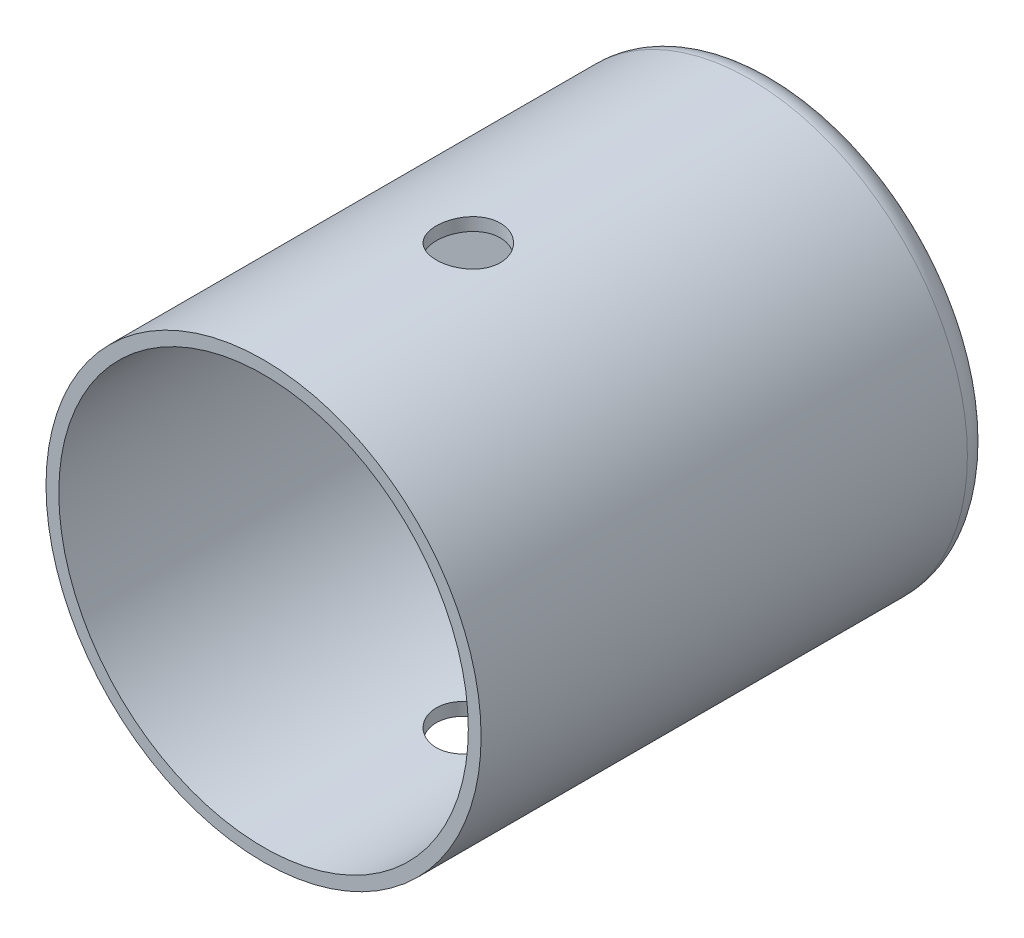
from build123d import *

# Parameters (mm, degrees)
SKETCH1_R               = 17
BOSS_EXTRUDE1_DEPTH     = 12
SKETCH2_R               = 17
SKETCH2_R_2             = 16
BOSS_EXTRUDE2_DEPTH     = 28
CUT_EXTRUDE1_DEPTH      = 47.669047558
CUT_EXTRUDE1_DEPTH_BACK = 47.669047558
SKETCH3_R               = 2.5
FILLET1_R               = 2


with BuildPart() as part:
    # Sketch1 → Boss-Extrude1 (new body)
    with BuildSketch(Plane.XY):
        Circle(SKETCH1_R)
    extrude(amount=BOSS_EXTRUDE1_DEPTH)

    # Sketch2 → Boss-Extrude2 (add)
    with BuildSketch(Plane.XY.offset(12)):
        Circle(SKETCH2_R)
        Circle(SKETCH2_R_2, mode=Mode.SUBTRACT)
    extrude(amount=BOSS_EXTRUDE2_DEPTH)

    # Sketch3 → Cut-Extrude1 (cut, two sides: drawn at the far end of the back side and taken through both)
    with BuildSketch(Plane(origin=(0, 0, 0), x_dir=(1, 0, 0), z_dir=(0, 1, 0)).offset(-CUT_EXTRUDE1_DEPTH_BACK)):
        with Locations(Location((0, -24, 0), (0, 0, 270))):
            Circle(SKETCH3_R)
    extrude(amount=CUT_EXTRUDE1_DEPTH + CUT_EXTRUDE1_DEPTH_BACK, mode=Mode.SUBTRACT)

    # Fillet1
    fillet1_edges = [part.edges().sort_by_distance(p)[0] for p in [
        (-17, 0, 0),
    ]]
    fillet(fillet1_edges, radius=FILLET1_R)


solid = part.part
